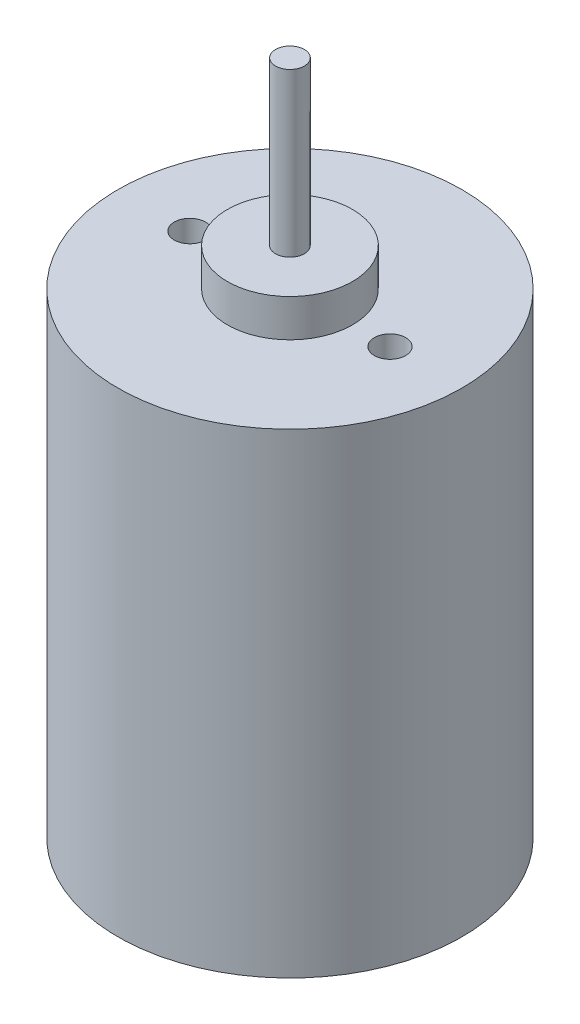
from build123d import *

# Parameters (mm, degrees)
SKETCH2_R          = 1.25
CUT_EXTRUDE1_DEPTH = 10


with BuildPart() as part:
    # Sketch1 → Revolve1 (revolve)
    with BuildSketch(Plane(origin=(0, 0, 0), x_dir=(0, 0, -1), z_dir=(1, 0, 0)), mode=Mode.PRIVATE) as revolve1_sk:
        Polygon((0, 57), (-1.15, 57), (-1.15, 44), (-5, 44), (-5, 41), (-13.75, 41), (-13.75, 3), (-5, 3), (-5, 0), (0, 0), align=None)
    revolve(revolve1_sk.sketch.rotate(Axis((0, 0, 0), (0, 1, 0)), 180), axis=Axis((0, 0, 0), (0, 1, 0)))

    # Sketch2 → Cut-Extrude1 (cut)
    with BuildSketch(Plane(origin=(0, 41, 0), x_dir=(1, 0, 0), z_dir=(0, 1, 0))):
        with Locations(Location((-8, 0, 0), (0, 0, 270))):
            Circle(SKETCH2_R)
        with Locations(Location((8, 0, 0), (0, 0, 270))):
            Circle(SKETCH2_R)
    extrude(amount=-CUT_EXTRUDE1_DEPTH, mode=Mode.SUBTRACT)


solid = part.part
